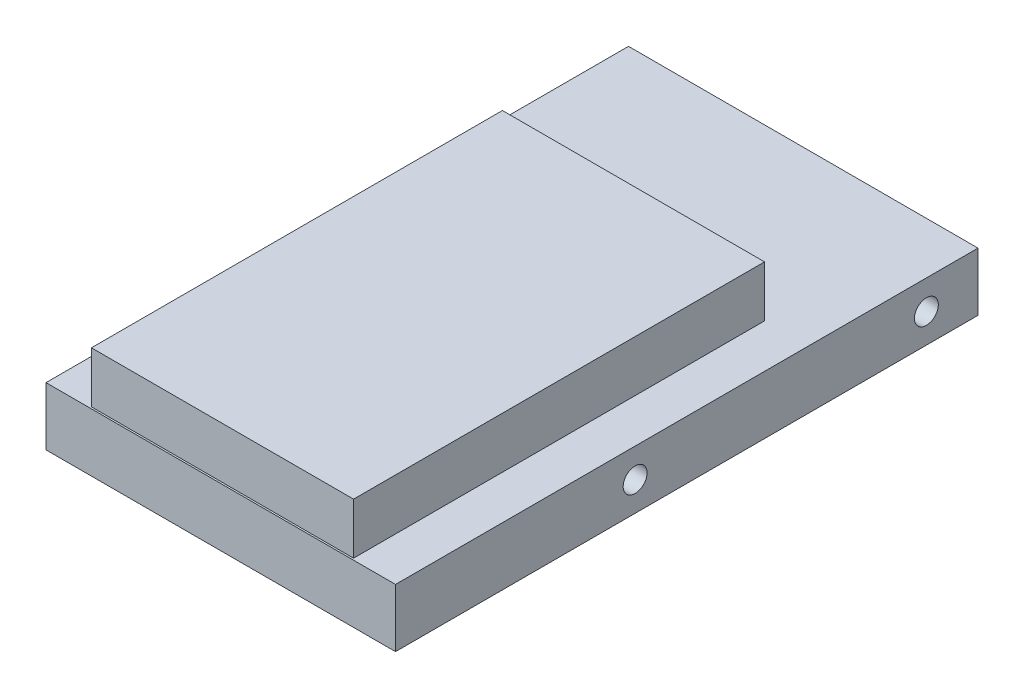
from build123d import *

# Parameters (mm, degrees)
SKETCH_1_W               = 100
SKETCH_1_H               = 10
EXTRUDE_1_DEPTH          = 30
CUT_EXTRUDE_1_DEPTH      = 105.880884817
CUT_EXTRUDE_1_DEPTH_BACK = 105.880884817
SKETCH_2_R               = 2.05
SKETCH_4_W               = 70.552340153
SKETCH_4_H               = 8.779398974
EXTRUDE_2_DEPTH          = 22.5


with BuildPart() as part:
    # 스케치1 → 보스-돌출1 (new, symmetric)
    with BuildSketch(Plane(origin=(0, 0, 0), x_dir=(0, 0, -1), z_dir=(1, 0, 0))):
        with Locations((50, 5)):
            Rectangle(SKETCH_1_W, SKETCH_1_H)
    extrude(amount=EXTRUDE_1_DEPTH, both=True)

    # 스케치2 → 컷-돌출1 (cut, two sides: drawn at the far end of the back side and taken through both)
    with BuildSketch(Plane(origin=(0, 0, 0), x_dir=(0, 0, -1), z_dir=(1, 0, 0)).offset(-CUT_EXTRUDE_1_DEPTH_BACK)):
        with Locations((41.137955169, 5)):
            Circle(SKETCH_2_R)
        with Locations((91.137955169, 5)):
            Circle(SKETCH_2_R)
    extrude(amount=CUT_EXTRUDE_1_DEPTH + CUT_EXTRUDE_1_DEPTH_BACK, mode=Mode.SUBTRACT)

    # 스케치4 → 보스-돌출2 (add, symmetric)
    with BuildSketch(Plane(origin=(0, 0, 0), x_dir=(0, 0, -1), z_dir=(1, 0, 0))):
        with Locations((35.576558904, 14.389699487)):
            Rectangle(SKETCH_4_W, SKETCH_4_H)
    extrude(amount=EXTRUDE_2_DEPTH, both=True)


solid = part.part
